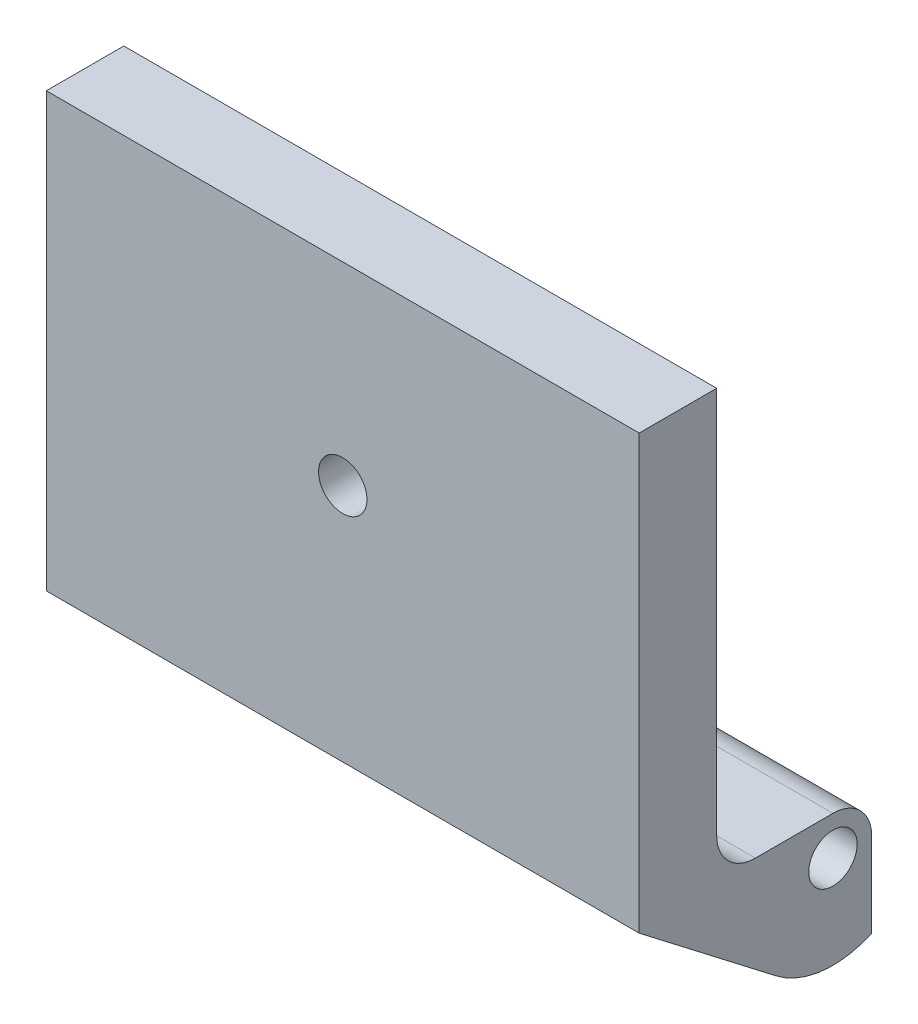
from build123d import *

# Parameters (mm, degrees)
SKETCH1_W           = 38.862
SKETCH1_H           = 25.4
BOSS_EXTRUDE1_DEPTH = 17.78
SKETCH2_R           = 1.5875
CUT_EXTRUDE1_DEPTH  = 45.583331459
CUT_EXTRUDE2_DEPTH  = 45.583331459
SKETCH4_W           = 38.862
SKETCH4_H           = 25.4
BOSS_EXTRUDE2_DEPTH = 5.08
SKETCH5_R           = 1.5875
CUT_EXTRUDE3_DEPTH  = 25.4
CUT_EXTRUDE4_DEPTH  = 56.027210941
CUT_EXTRUDE5_DEPTH  = 56.027210941


with BuildPart() as part:
    # Sketch1 → Boss-Extrude1 (new body)
    with BuildSketch(Plane(origin=(0, 0, 0), x_dir=(1, 0, 0), z_dir=(0, 1, 0))):
        Rectangle(SKETCH1_W, SKETCH1_H)
    extrude(amount=BOSS_EXTRUDE1_DEPTH)

    # Sketch2 → Cut-Extrude1 (cut, through all)
    with BuildSketch(Plane(origin=(19.431, 0, 0), x_dir=(0, 0, -1), z_dir=(1, 0, 0))):
        with Locations((0, 6.35)):
            Circle(SKETCH2_R)
    extrude(amount=-CUT_EXTRUDE1_DEPTH, mode=Mode.SUBTRACT)

    # Sketch3 → Cut-Extrude2 (cut, through all)
    with BuildSketch(Plane(origin=(19.431, 0, 0), x_dir=(0, 0, -1), z_dir=(1, 0, 0))):
        with BuildLine():
            Line((-7.62, 17.78), (-7.62, 11.43))
            ThreePointArc((-7.62, 11.43), (-6.876051224, 9.633948776), (-5.08, 8.89))
            Line((-5.08, 8.89), (0, 8.89))
            ThreePointArc((0, 8.89), (1.796051224, 8.146051224), (2.54, 6.35))
            Line((2.54, 6.35), (2.54, 0))
            Line((2.54, 0), (12.7, 0))
            Line((12.7, 0), (12.7, 17.78))
            Line((12.7, 17.78), (-7.62, 17.78))
        make_face()
    extrude(amount=-CUT_EXTRUDE2_DEPTH, mode=Mode.SUBTRACT)

    # Sketch4 → Boss-Extrude2 (add)
    with BuildSketch(Plane(origin=(0, 0, 7.62), x_dir=(-1, 0, 0), z_dir=(0, 0, -1))):
        with Locations((0, 24.13)):
            Rectangle(SKETCH4_W, SKETCH4_H)
    extrude(amount=-BOSS_EXTRUDE2_DEPTH)

    # Sketch5 → Cut-Extrude3 (cut)
    with BuildSketch(Plane(origin=(0, 0, 7.62), x_dir=(-1, 0, 0), z_dir=(0, 0, -1))):
        with Locations(Location((0, 24.13, 0), (0, 0, 90))):
            Circle(SKETCH5_R)
    extrude(amount=-CUT_EXTRUDE3_DEPTH, mode=Mode.SUBTRACT)

    # Sketch6 → Cut-Extrude4 (cut, through all)
    with BuildSketch(Plane(origin=(19.431, 0, 0), x_dir=(0, 0, -1), z_dir=(1, 0, 0))):
        with BuildLine():
            ThreePointArc((2.1e-08, 0), (-2.046508636, 0.338818552), (-3.874625133, 1.319117366))
            Line((-3.874625133, 1.319117366), (-12.7, 8.116139232))
            Line((-12.7, 8.116139232), (-12.7, 0))
            Line((-12.7, 0), (2.1e-08, 0))
        make_face()
        with BuildLine():
            ThreePointArc((2.54, 0.530128867), (1.297366248, 0.133944915), (2.1e-08, 0))
            Line((2.1e-08, 0), (2.54, 0))
            Line((2.54, 0), (2.54, 0.530128867))
        make_face()
    extrude(amount=-CUT_EXTRUDE4_DEPTH, mode=Mode.SUBTRACT)

    # Sketch7 → Cut-Extrude5 (cut, through all)
    with BuildSketch(Plane(origin=(19.431, 0, 0), x_dir=(0, 0, -1), z_dir=(1, 0, 0))):
        with BuildLine():
            Line((-12.7, 8.436739039), (-3.719640128, 1.520352671))
            ThreePointArc((-3.719640128, 1.520352671), (-0.688923818, 0.293053577), (2.54, 0.808374246))
            Line((2.54, 0.808374246), (2.54, 0.530128867))
            ThreePointArc((2.54, 0.530128867), (-0.775197894, 0.047495083), (-3.874625133, 1.319117366))
            Line((-3.874625133, 1.319117366), (-12.7, 8.116139232))
            Line((-12.7, 8.116139232), (-12.7, 8.436739039))
        make_face()
    extrude(amount=-CUT_EXTRUDE5_DEPTH, mode=Mode.SUBTRACT)


solid = part.part
